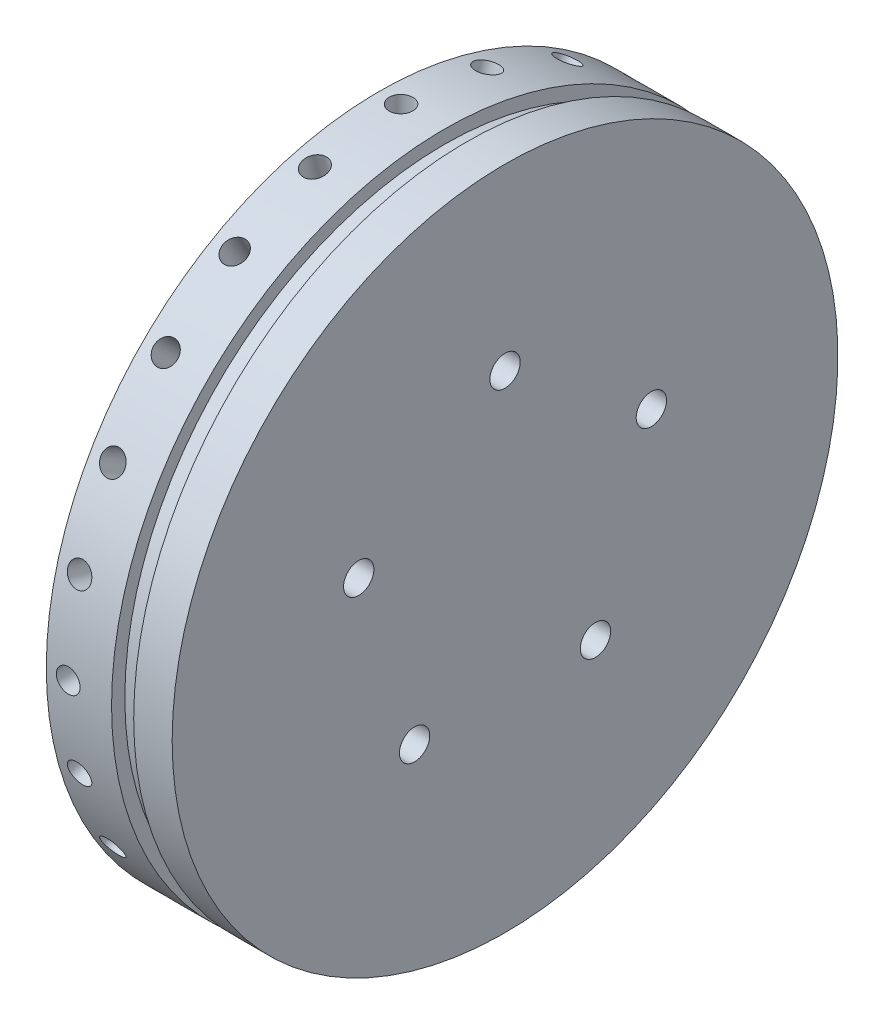
from build123d import *

# Parameters (mm, degrees)
PORT_1_THREAD_BORE_SKETCH_R = 4.953
PORT_1_THREAD_BORE_DEPTH    = 10.5
PORT_1_PASSAGE_SKETCH_R     = 3.25
PORT_1_PASSAGE_DEPTH        = 11.5
PORT_2_THREAD_BORE_SKETCH_R = 4.953
PORT_2_THREAD_BORE_DEPTH    = 10.5
PORT_2_PASSAGE_SKETCH_R     = 3.25
PORT_2_PASSAGE_DEPTH        = 11.5
PORT_3_THREAD_BORE_SKETCH_R = 4.953
PORT_3_THREAD_BORE_DEPTH    = 10.5
PORT_3_PASSAGE_SKETCH_R     = 3.25
PORT_3_PASSAGE_DEPTH        = 11.5
PORT_4_THREAD_BORE_SKETCH_R = 4.953
PORT_4_THREAD_BORE_DEPTH    = 10.5
PORT_4_PASSAGE_SKETCH_R     = 3.25
PORT_4_PASSAGE_DEPTH        = 11.5
PORT_5_THREAD_BORE_SKETCH_R = 4.953
PORT_5_THREAD_BORE_DEPTH    = 10.5
PORT_5_PASSAGE_SKETCH_R     = 3.25
PORT_5_PASSAGE_DEPTH        = 11.5
SCREW_HOLE_SKETCH_W         = 2.55
SCREW_HOLE_SKETCH_H         = 11.5
SCREW_HOLES_X24_COUNT       = 24


with BuildPart() as part:
    # Cap Body Sketch → Cap Body (revolve)
    with BuildSketch(Plane.XY):
        Polygon((13, 0), (13, 58), (8, 58), (8, 71.4), (22, 71.4), (22, 68.555), (26.75, 68.555), (26.75, 71.4), (35, 71.4), (35, 0), align=None)
    revolve(axis=Axis((-1000, 0, 0), (1, 0, 0)))

    # Port 1 Thread Bore Sketch → Port 1 Thread Bore (cut)
    with BuildSketch(Plane(origin=(13, 0, 0), x_dir=(0, 0, -1), z_dir=(1, 0, 0))):
        with Locations((0, 33)):
            Circle(PORT_1_THREAD_BORE_SKETCH_R)
    extrude(amount=PORT_1_THREAD_BORE_DEPTH, mode=Mode.SUBTRACT)

    # Port 1 Passage Sketch → Port 1 Passage (cut)
    with BuildSketch(Plane(origin=(23.5, 0, 0), x_dir=(0, 0, -1), z_dir=(1, 0, 0))):
        with Locations((0, 33)):
            Circle(PORT_1_PASSAGE_SKETCH_R)
    extrude(amount=PORT_1_PASSAGE_DEPTH, mode=Mode.SUBTRACT)

    # Port 2 Thread Bore Sketch → Port 2 Thread Bore (cut)
    with BuildSketch(Plane(origin=(13, 0, 0), x_dir=(0, 0, -1), z_dir=(1, 0, 0))):
        with Locations((31.384865038, 10.197560814)):
            Circle(PORT_2_THREAD_BORE_SKETCH_R)
    extrude(amount=PORT_2_THREAD_BORE_DEPTH, mode=Mode.SUBTRACT)

    # Port 2 Passage Sketch → Port 2 Passage (cut)
    with BuildSketch(Plane(origin=(23.5, 0, 0), x_dir=(0, 0, -1), z_dir=(1, 0, 0))):
        with Locations((31.384865038, 10.197560814)):
            Circle(PORT_2_PASSAGE_SKETCH_R)
    extrude(amount=PORT_2_PASSAGE_DEPTH, mode=Mode.SUBTRACT)

    # Port 3 Thread Bore Sketch → Port 3 Thread Bore (cut)
    with BuildSketch(Plane(origin=(13, 0, 0), x_dir=(0, 0, -1), z_dir=(1, 0, 0))):
        with Locations((19.396913326, -26.697560814)):
            Circle(PORT_3_THREAD_BORE_SKETCH_R)
    extrude(amount=PORT_3_THREAD_BORE_DEPTH, mode=Mode.SUBTRACT)

    # Port 3 Passage Sketch → Port 3 Passage (cut)
    with BuildSketch(Plane(origin=(23.5, 0, 0), x_dir=(0, 0, -1), z_dir=(1, 0, 0))):
        with Locations((19.396913326, -26.697560814)):
            Circle(PORT_3_PASSAGE_SKETCH_R)
    extrude(amount=PORT_3_PASSAGE_DEPTH, mode=Mode.SUBTRACT)

    # Port 4 Thread Bore Sketch → Port 4 Thread Bore (cut)
    with BuildSketch(Plane(origin=(13, 0, 0), x_dir=(0, 0, -1), z_dir=(1, 0, 0))):
        with Locations((-19.396913326, -26.697560814)):
            Circle(PORT_4_THREAD_BORE_SKETCH_R)
    extrude(amount=PORT_4_THREAD_BORE_DEPTH, mode=Mode.SUBTRACT)

    # Port 4 Passage Sketch → Port 4 Passage (cut)
    with BuildSketch(Plane(origin=(23.5, 0, 0), x_dir=(0, 0, -1), z_dir=(1, 0, 0))):
        with Locations((-19.396913326, -26.697560814)):
            Circle(PORT_4_PASSAGE_SKETCH_R)
    extrude(amount=PORT_4_PASSAGE_DEPTH, mode=Mode.SUBTRACT)

    # Port 5 Thread Bore Sketch → Port 5 Thread Bore (cut)
    with BuildSketch(Plane(origin=(13, 0, 0), x_dir=(0, 0, -1), z_dir=(1, 0, 0))):
        with Locations((-31.384865038, 10.197560814)):
            Circle(PORT_5_THREAD_BORE_SKETCH_R)
    extrude(amount=PORT_5_THREAD_BORE_DEPTH, mode=Mode.SUBTRACT)

    # Port 5 Passage Sketch → Port 5 Passage (cut)
    with BuildSketch(Plane(origin=(23.5, 0, 0), x_dir=(0, 0, -1), z_dir=(1, 0, 0))):
        with Locations((-31.384865038, 10.197560814)):
            Circle(PORT_5_PASSAGE_SKETCH_R)
    extrude(amount=PORT_5_PASSAGE_DEPTH, mode=Mode.SUBTRACT)

    # Screw Hole Sketch → Screw Hole (revolve, cut)
    with BuildSketch(Plane.XY):
        with Locations((13.975, 66.65)):
            Rectangle(SCREW_HOLE_SKETCH_W, SCREW_HOLE_SKETCH_H)
    screw_hole = revolve(axis=Axis((12.7, 51.4, 0), (0, 1, 0)), mode=Mode.SUBTRACT)

    # Screw Holes x24: Screw Hole ×24 about axis
    screw_holes_x24_axis = Axis((36.35, 0, 0), (-1, 0, 0))
    for i in range(1, SCREW_HOLES_X24_COUNT):
        add(screw_hole.rotate(screw_holes_x24_axis, i * 360 / SCREW_HOLES_X24_COUNT), mode=Mode.SUBTRACT)


solid = part.part
